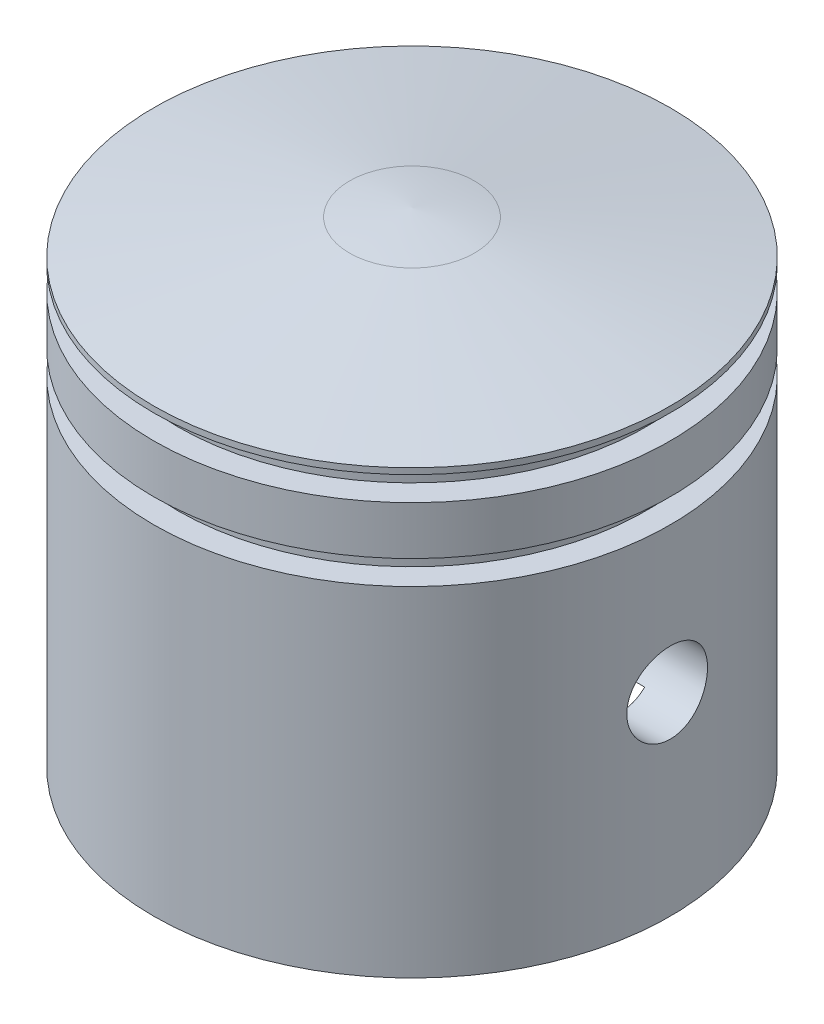
from build123d import *

# Parameters (mm, degrees)
SKETCH2_W               = 3.280741235
SKETCH2_H               = 1.5
SKETCH3_R               = 10
CUT_EXTRUDE1_DEPTH      = 24
SKETCH4_R               = 13
CUT_EXTRUDE2_DEPTH      = 10
CUT_EXTRUDE4_DEPTH      = 38.576588536
CUT_EXTRUDE4_DEPTH_BACK = 38.576588536
SKETCH5_R               = 2.5


with BuildPart() as part:
    # Sketch1 → Revolve1 (revolve)
    with BuildSketch(Plane.XY, mode=Mode.PRIVATE) as revolve1_sk:
        with BuildLine():
            Line((0, 0), (16, 0))
            Line((16, 0), (16, 27.372152659))
            Line((16, 27.372152659), (3.872487753, 29.510560277))
            ThreePointArc((3.872487753, 29.510560277), (1.94221752, 29.802544105), (0, 30))
            Line((0, 30), (0, 0))
        make_face()
    revolve(revolve1_sk.sketch.rotate(Axis((0, 30, 0), (0, -1, 0)), 90), axis=Axis((0, 30, 0), (0, -1, 0)))

    # Sketch2 → Cut-Revolve1 (revolve, cut)
    with BuildSketch(Plane.XY, mode=Mode.PRIVATE) as cut_revolve1_sk:
        with Locations((16.140370618, 26.25)):
            Rectangle(SKETCH2_W, SKETCH2_H)
        with Locations((16.140370618, 21.75)):
            Rectangle(SKETCH2_W, SKETCH2_H)
    revolve(cut_revolve1_sk.sketch.rotate(Axis((0, 0, 0), (0, 1, 0)), 270), axis=Axis((0, 0, 0), (0, 1, 0)), mode=Mode.SUBTRACT)

    # Sketch3 → Cut-Extrude1 (cut)
    with BuildSketch(Plane.XZ):
        with Locations(Location((0, 0, 0), (0, 0, 270))):
            Circle(SKETCH3_R)
    extrude(amount=-CUT_EXTRUDE1_DEPTH, mode=Mode.SUBTRACT)

    # Sketch4 → Cut-Extrude2 (cut)
    with BuildSketch(Plane.XZ):
        with Locations(Location((0, 0, 0), (0, 0, 270))):
            Circle(SKETCH4_R)
    extrude(amount=-CUT_EXTRUDE2_DEPTH, mode=Mode.SUBTRACT)

    # Sketch5 → Cut-Extrude4 (cut, two sides: drawn at the far end of the back side and taken through both)
    with BuildSketch(Plane(origin=(0, 0, 0), x_dir=(0, 0, -1), z_dir=(1, 0, 0)).offset(-CUT_EXTRUDE4_DEPTH_BACK)):
        with Locations(Location((0, 12, 0), (0, 0, 306.869897646))):
            Circle(SKETCH5_R)
    extrude(amount=CUT_EXTRUDE4_DEPTH + CUT_EXTRUDE4_DEPTH_BACK, mode=Mode.SUBTRACT)


solid = part.part
